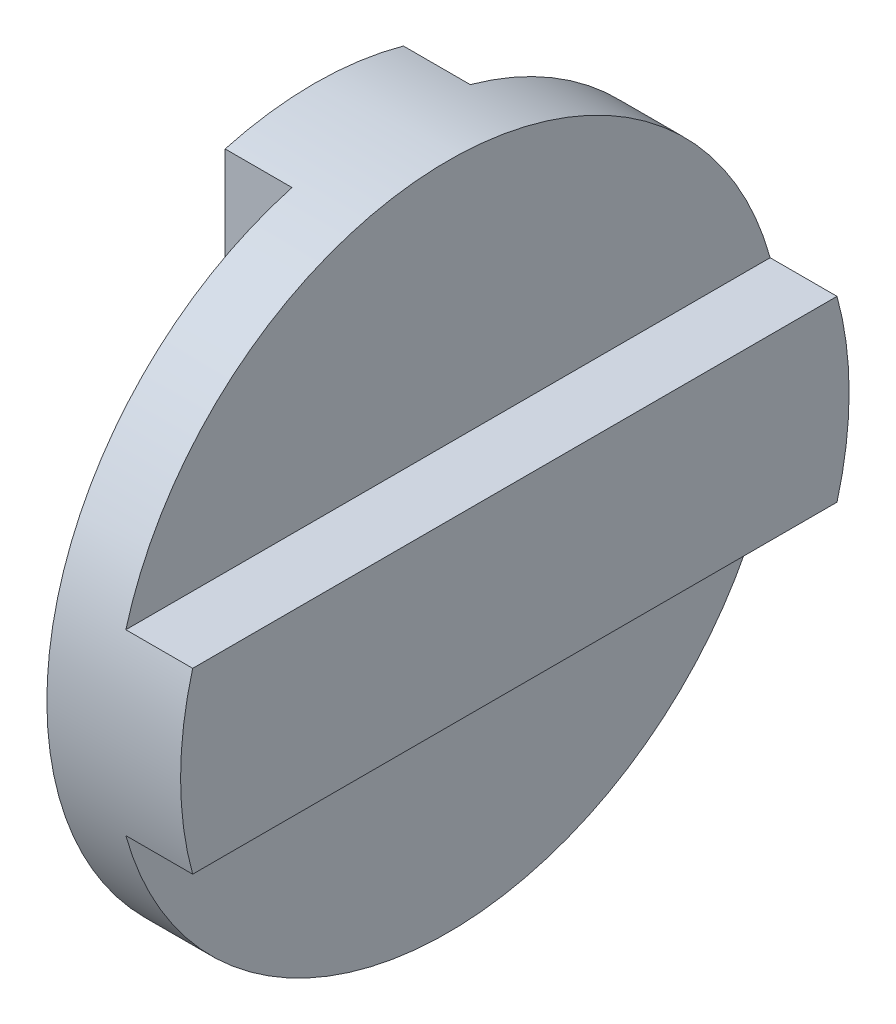
from build123d import *
from build123d.topology import SkipClean

# Parameters (mm, degrees)
SKETCH1_R           = 75
BOSS_EXTRUDE1_DEPTH = 15
BOSS_EXTRUDE2_DEPTH = 15
BOSS_EXTRUDE3_START = 15
BOSS_EXTRUDE3_DEPTH = 15


with BuildPart() as part:
    # Sketch1 → Boss-Extrude1 (new body)
    with BuildSketch(Plane(origin=(0, 0, 0), x_dir=(0, 0, -1), z_dir=(1, 0, 0))):
        Circle(SKETCH1_R)
    extrude(amount=BOSS_EXTRUDE1_DEPTH)

    # Sketch2 → Boss-Extrude2 (add)
    with BuildSketch(Plane(origin=(15, 0, 0), x_dir=(0, 0, -1), z_dir=(1, 0, 0))):
        with BuildLine():
            Line((-72.284161474, -20), (72.284161474, -20))
            ThreePointArc((72.284161474, -20), (75, 0), (72.284161474, 20))
            Line((72.284161474, 20), (-72.284161474, 20))
            ThreePointArc((-72.284161474, 20), (-75, 0), (-72.284161474, -20))
        make_face()
    extrude(amount=BOSS_EXTRUDE2_DEPTH)

    # Sketch3 → Boss-Extrude3 (add)
    with SkipClean():  # the faces are left unmerged after this step: merging them gives an invalid solid
        with BuildSketch(Plane.ZY.offset(BOSS_EXTRUDE3_START)):
            with BuildLine():
                Line((-20, 72.284161474), (-20, -72.284161474))
                ThreePointArc((-20, -72.284161474), (0, -75), (20, -72.284161474))
                Line((20, -72.284161474), (20, 72.284161474))
                ThreePointArc((20, 72.284161474), (0, 75), (-20, 72.284161474))
            make_face()
        extrude(amount=-BOSS_EXTRUDE3_DEPTH)


solid = part.part
